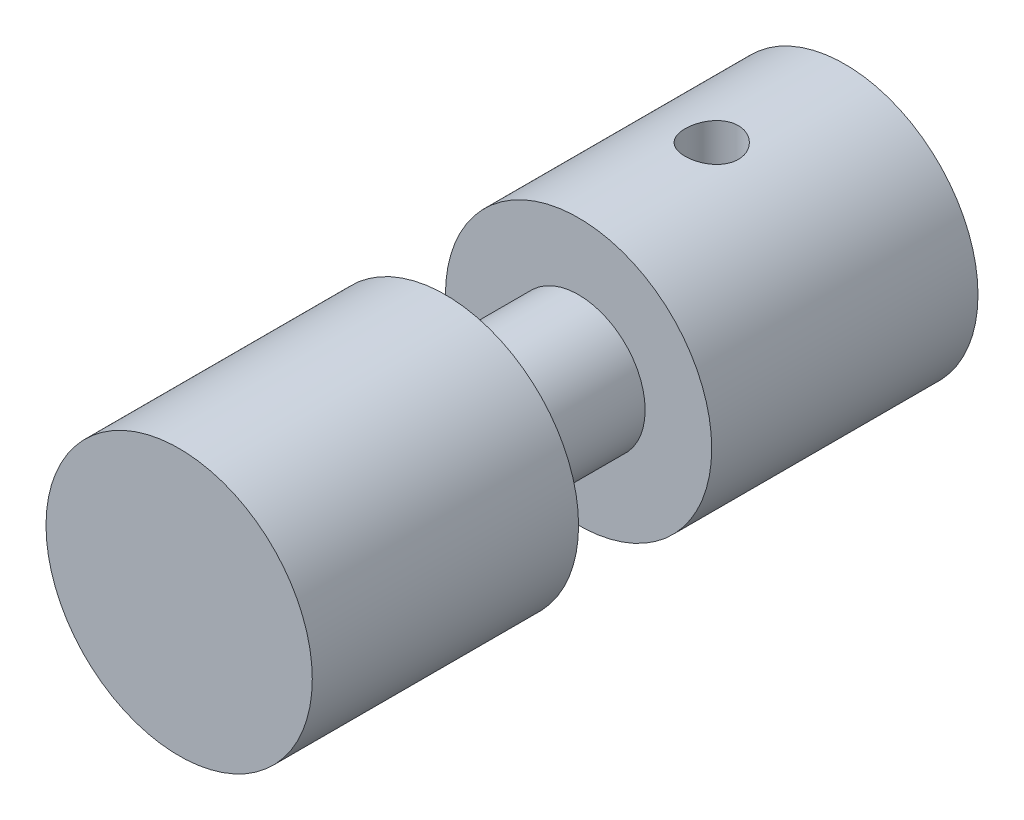
from build123d import *

# Parameters (mm, degrees)
ESQUISSE1_R                  = 5
BOSS_EXTRU_1_DEPTH           = 10
ESQUISSE2_R                  = 2.5
BOSS_EXTRU_2_DEPTH           = 5
ESQUISSE3_R                  = 5
BOSS_EXTRU_4_DEPTH           = 10
ESQUISSE4_R                  = 1.5
ENL_V_MAT_EXTRU_1_DEPTH      = 10
ENL_V_MAT_EXTRU_2_DEPTH      = 10
ENL_V_MAT_EXTRU_2_DEPTH_BACK = 10
ESQUISSE5_R                  = 1


with BuildPart() as part:
    # Esquisse1 → Boss.-Extru.1 (new body)
    with BuildSketch(Plane.XY):
        Circle(ESQUISSE1_R)
    extrude(amount=BOSS_EXTRU_1_DEPTH)

    # Esquisse2 → Boss.-Extru.2 (add)
    with BuildSketch(Plane.XY.offset(10)):
        Circle(ESQUISSE2_R)
    extrude(amount=BOSS_EXTRU_2_DEPTH)

    # Esquisse3 → Boss.-Extru.4 (add)
    with BuildSketch(Plane.XY.offset(15)):
        Circle(ESQUISSE3_R)
    extrude(amount=BOSS_EXTRU_4_DEPTH)

    # Esquisse4 → Enlèv. mat.-Extru.1 (cut)
    with BuildSketch(Plane(origin=(0, 0, 0), x_dir=(-1, 0, 0), z_dir=(0, 0, -1))):
        Circle(ESQUISSE4_R)
    extrude(amount=-ENL_V_MAT_EXTRU_1_DEPTH, mode=Mode.SUBTRACT)

    # Esquisse5 → Enlèv. mat.-Extru.2 (cut, two sides: drawn at the far end of the back side and taken through both)
    with BuildSketch(Plane(origin=(0, 0, 0), x_dir=(1, 0, 0), z_dir=(0, 1, 0)).offset(-ENL_V_MAT_EXTRU_2_DEPTH_BACK)):
        with Locations((0, -5)):
            Circle(ESQUISSE5_R)
    extrude(amount=ENL_V_MAT_EXTRU_2_DEPTH + ENL_V_MAT_EXTRU_2_DEPTH_BACK, mode=Mode.SUBTRACT)


solid = part.part
